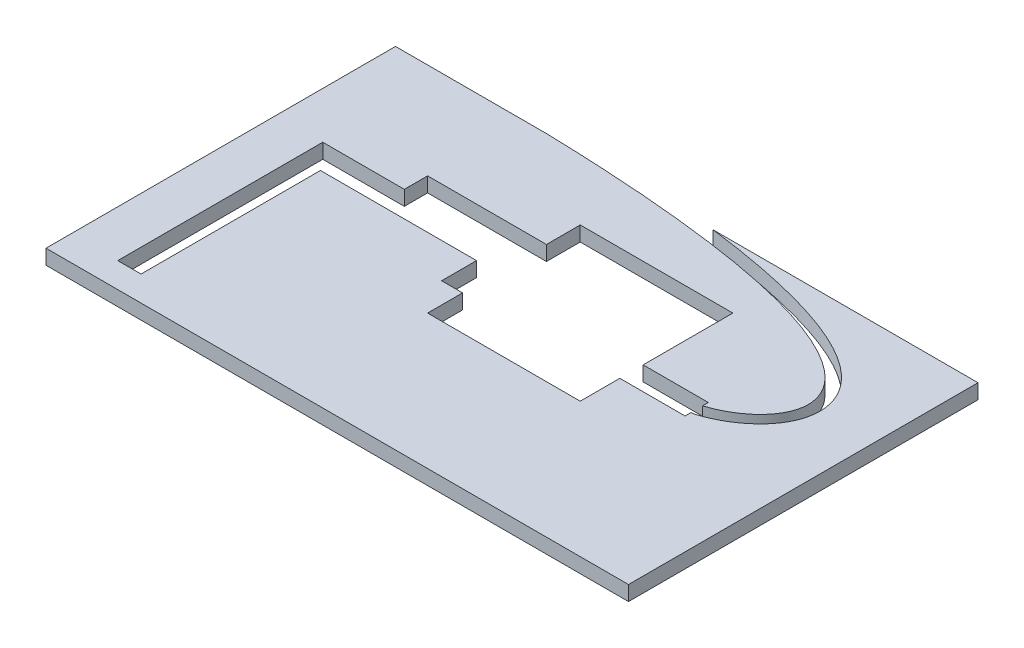
from build123d import *

# Parameters (mm, degrees)
BOSS_EXTRUDE1_DEPTH = 6.35


with BuildPart() as part:
    # Sketch1 → Boss-Extrude1 (new body)
    with BuildSketch(Plane(origin=(0, 0, 0), x_dir=(1, 0, 0), z_dir=(0, 1, 0))):
        with BuildLine():
            Line((-105, -64.215517859), (-95, -64.215517859))
            Line((-95, -64.215517859), (-95, 12.784482141))
            Line((-95, 12.784482141), (-28, 12.784482141))
            Line((-28, 12.784482141), (-28, -2.215517859))
            Line((-28, -2.215517859), (-19, -2.215517859))
            Line((-19, -2.215517859), (-19, -17.215517859))
            Line((-19, -17.215517859), (46.5, -17.215517859))
            Line((46.5, -17.215517859), (46.5, -0.215517859))
            Line((46.5, -0.215517859), (74.5, -0.215517859))
            Line((74.5, -0.215517859), (74.5, 2.284482141))
            Line((74.5, 2.284482141), (75.995811983, 2.513471084))
            add(Edge.make_bspline(
                [(75.995811983, 2.513471084), (80.478945809, 3.91902752), (86.955874182, 7.104080495), (94.127927524, 13.158287334), (98.453325684, 18.591579482), (101.313529062, 24.942550659), (102.069690209, 32.110869763), (100.125264278, 39.491428955), (95.470460142, 46.405997638), (88.214059069, 52.733240312), (78.176732194, 58.54884887), (65.04289901, 63.866927528), (48.466875468, 68.636346268), (31.498822927, 72.078754421), (18.408481383, 74.071157306), (12.810694193, 74.812442252), (11.34053229, 75)],
                knots=[0, 0, 0, 0, 0.125, 0.1875, 0.25, 0.3125, 0.375, 0.4375, 0.5, 0.5625, 0.625, 0.6875, 0.75, 0.8125, 0.84375, 0.854655416, 0.854655416, 0.854655416, 0.854655416], degree=3))
            Line((11.34053229, 75), (125, 75))
            Line((125, 75), (125, -75))
            Line((125, -75), (-125, -75))
            Line((-125, -75), (-125, 75))
            Line((-125, 75), (-60, 75))
            add(Edge.make_bspline(
                [(74.5, 7.284482141), (106.249859102, 17.238728555), (132.436668925, 69.90318377), (-60, 75)],
                knots=[0, 0, 0, 0, 1, 1, 1, 1], degree=3))
            Line((74.5, 7.284482141), (74.5, 9.784482141))
            Line((74.5, 9.784482141), (46.5, 9.784482141))
            Line((46.5, 9.784482141), (46.5, 48.284482141))
            Line((46.5, 48.284482141), (-19, 48.284482141))
            Line((-19, 48.284482141), (-19, 33.784482141))
            Line((-19, 33.784482141), (-70, 33.784482141))
            Line((-70, 33.784482141), (-70, 23.784482141))
            Line((-70, 23.784482141), (-105, 23.784482141))
            Line((-105, 23.784482141), (-105, -64.215517859))
        make_face()
    extrude(amount=BOSS_EXTRUDE1_DEPTH)


solid = part.part
